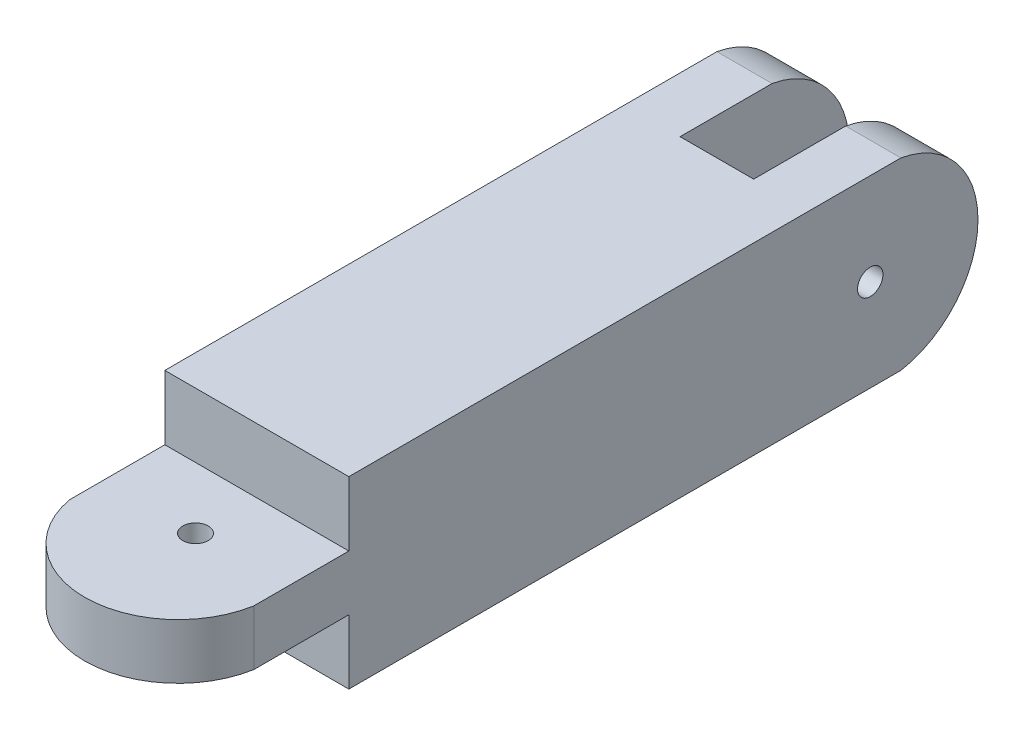
from build123d import *

# Parameters (mm, degrees)
SKETCH2_W               = 60
SKETCH2_H               = 60
BOSS_EXTRUDE1_DEPTH     = 150
SKETCH3_W               = 18
SKETCH3_H               = 60
BOSS_EXTRUDE2_DEPTH     = 30
BOSS_EXTRUDE3_DEPTH     = 18
BOSS_EXTRUDE4_START     = -18
BOSS_EXTRUDE4_DEPTH     = 18
SKETCH6_W               = 60
SKETCH6_H               = 18
BOSS_EXTRUDE5_DEPTH     = 31
BOSS_EXTRUDE6_DEPTH     = 18
CUT_EXTRUDE2_DEPTH      = 5
CUT_EXTRUDE2_DEPTH_BACK = 130
CUT_EXTRUDE2_START      = -10
SKETCH8_W               = 50.5
SKETCH8_H               = 50.5
SKETCH9_R               = 4.15
CUT_EXTRUDE3_DEPTH      = 130
SKETCH11_R              = 4.15
CUT_EXTRUDE4_DEPTH      = 213.502318917
SKETCH12_R              = 4.15
CUT_EXTRUDE5_DEPTH      = 213.502318917


with BuildPart() as part:
    # Sketch2 → Boss-Extrude1 (new body)
    with BuildSketch(Plane.XY):
        Rectangle(SKETCH2_W, SKETCH2_H)
    extrude(amount=BOSS_EXTRUDE1_DEPTH)

    # Sketch3 → Boss-Extrude2 (add)
    with BuildSketch(Plane(origin=(0, 0, 0), x_dir=(-1, 0, 0), z_dir=(0, 0, -1))):
        with Locations((21, 0)):
            Rectangle(SKETCH3_W, SKETCH3_H)
        with Locations((-21, 0)):
            Rectangle(SKETCH3_W, SKETCH3_H)
    extrude(amount=BOSS_EXTRUDE2_DEPTH)

    # Sketch4 → Boss-Extrude3 (add)
    with BuildSketch(Plane(origin=(30, 0, 0), x_dir=(0, 0, -1), z_dir=(1, 0, 0))):
        with BuildLine():
            Line((30, 30), (30, -30))
            ThreePointArc((30, -30), (55.138874415, 0), (30, 30))
        make_face()
    extrude(amount=-BOSS_EXTRUDE3_DEPTH)

    # Sketch5 → Boss-Extrude4 (add)
    with BuildSketch(Plane.ZY.offset(30).offset(BOSS_EXTRUDE4_START)):
        with BuildLine():
            Line((-30, -30), (-30, 30))
            ThreePointArc((-30, 30), (-55.138874415, 0), (-30, -30))
        make_face()
    extrude(amount=BOSS_EXTRUDE4_DEPTH)

    # Sketch6 → Boss-Extrude5 (add)
    with BuildSketch(Plane.XY.offset(150)):
        Rectangle(SKETCH6_W, SKETCH6_H)
    extrude(amount=BOSS_EXTRUDE5_DEPTH)

    # Sketch7 → Boss-Extrude6 (add)
    with BuildSketch(Plane(origin=(0, 9, 0), x_dir=(1, 0, 0), z_dir=(0, 1, 0))):
        with BuildLine():
            Line((30, -181), (-30, -181))
            ThreePointArc((-30, -181), (0, -206.138874415), (30, -181))
        make_face()
    extrude(amount=-BOSS_EXTRUDE6_DEPTH)

    # Sketch8 → Cut-Extrude2 (cut, two sides: drawn at the far end of the back side and taken through both)
    with BuildSketch(Plane.XY.offset(150).offset(CUT_EXTRUDE2_START - CUT_EXTRUDE2_DEPTH_BACK)):
        Rectangle(SKETCH8_W, SKETCH8_H)
    extrude(amount=CUT_EXTRUDE2_DEPTH + CUT_EXTRUDE2_DEPTH_BACK, mode=Mode.SUBTRACT)

    # Sketch9 → Cut-Extrude3 (cut)
    with BuildSketch(Plane(origin=(0, -9, 0), x_dir=(-1, 0, 0), z_dir=(0, -1, 0))):
        with Locations(Location((0, -170, 0), (0, 0, 90))):
            Circle(SKETCH9_R)
    extrude(amount=-CUT_EXTRUDE3_DEPTH, mode=Mode.SUBTRACT)

    # Sketch11 → Cut-Extrude4 (cut, through all)
    with BuildSketch(Plane.ZY.offset(-12)):
        with Locations(Location((-20, 0, 0), (0, 0, 270))):
            Circle(SKETCH11_R)
    extrude(amount=-CUT_EXTRUDE4_DEPTH, mode=Mode.SUBTRACT)

    # Sketch12 → Cut-Extrude5 (cut, through all)
    with BuildSketch(Plane(origin=(-12, 0, 0), x_dir=(0, 0, -1), z_dir=(1, 0, 0))):
        with Locations(Location((20, 0, 0), (0, 0, 270))):
            Circle(SKETCH12_R)
    extrude(amount=-CUT_EXTRUDE5_DEPTH, mode=Mode.SUBTRACT)


solid = part.part
